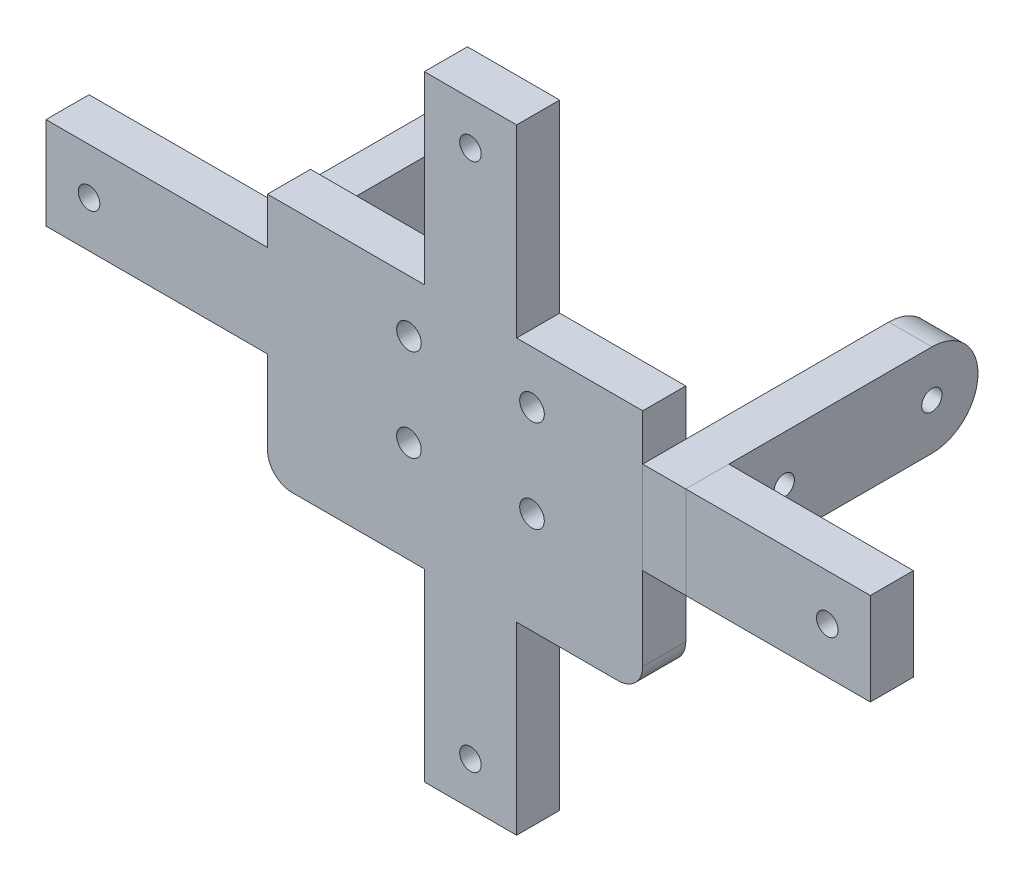
from build123d import *

# Parameters (mm, degrees)
EXTRUDE_START       = 24.2
SKETCH_4_W          = 61
SKETCH_4_H          = 7
EXTRUDE_1_DEPTH     = 6
SKETCH_5_W          = 40
SKETCH_5_H          = 34
SKETCH_5_R          = 2
EXTRUDE_2_DEPTH     = 7
EXTRUDE_START_2     = -9.8
SKETCH_7_R          = 4.1
EXTRUDE_3_DEPTH     = 7
EXTRUDE_START_3     = -55
SKETCH_9_R          = 1.65
EXTRUDE_4_DEPTH     = 6
EXTRUDE_START_4     = -22.5
EXTRUDE_5_DEPTH     = 7
EXTRUDE_START_5     = 28
SKETCH_14_R         = 1.65
EXTRUDE_8_DEPTH     = 7
SKETCH_17_R         = 3
SKETCH_17_R_2       = 1.5
EXTRUDE_11_DEPTH    = 0.5
SKETCH_21_W         = 15
SKETCH_21_H         = 30
SKETCH_21_R         = 1.75
SKETCH_21_W_2       = 30
SKETCH_21_H_2       = 15
EXTRUDE_12_DEPTH    = 7
SKETCH_22_W         = 40
SKETCH_22_H         = 7
CUT_EXTRUDE_1_DEPTH = 23


with BuildPart() as part:
    # 草图4 → 凸台-拉伸1 (new body)
    with BuildSketch(Plane(origin=(0, 0, 0), x_dir=(1, 0, 0), z_dir=(0, 1, 0)).offset(EXTRUDE_START)):
        with Locations((-2.5, 26)):
            Rectangle(SKETCH_4_W, SKETCH_4_H)
    extrude(amount=EXTRUDE_1_DEPTH)

    # 草图5 → 凸台-拉伸2 (add)
    with BuildSketch(Plane(origin=(0, 0, -29.5), x_dir=(-1, 0, 0), z_dir=(0, 0, -1))):
        with Locations((0, 7.2)):
            Rectangle(SKETCH_5_W, SKETCH_5_H)
        with Locations((-10, 21.7)):
            Circle(SKETCH_5_R, mode=Mode.SUBTRACT)
        with Locations(Location((10, 21.7, 0), (0, 0, 180))):
            Circle(SKETCH_5_R, mode=Mode.SUBTRACT)
        with Locations((10, 6.7)):
            Circle(SKETCH_5_R, mode=Mode.SUBTRACT)
        with Locations(Location((-10, 6.7, 0), (0, 0, 180))):
            Circle(SKETCH_5_R, mode=Mode.SUBTRACT)
    extrude(amount=-EXTRUDE_2_DEPTH)

    # 草图7 → 凸台-拉伸3 (add)
    with BuildSketch(Plane(origin=(0, 0, 0), x_dir=(1, 0, 0), z_dir=(0, 1, 0)).offset(EXTRUDE_START_2)):
        with BuildLine():
            Line((20, 22.5), (-20, 22.5))
            Line((-20, 22.5), (-20, 2.5))
            ThreePointArc((-20, 2.5), (-19.121320344, 0.378679656), (-17, -0.5))
            Line((-17, -0.5), (17, -0.5))
            ThreePointArc((17, -0.5), (19.121320344, 0.378679656), (20, 2.5))
            Line((20, 2.5), (20, 22.5))
        make_face()
        with Locations(Location((10, 10, 0), (0, 0, 90))):
            Circle(SKETCH_7_R, mode=Mode.SUBTRACT)
    extrude(amount=EXTRUDE_3_DEPTH)



with BuildPart() as body_2:
    # 草图9 → 凸台-拉伸4 (new body)
    with BuildSketch(Plane(origin=(22, 25.2, -43.868265324), x_dir=(0, 0, 1), z_dir=(1, 0, 0)).offset(EXTRUDE_START_3)):
        with BuildLine():
            Line((-18.631734676, 2.5), (21.368265324, 2.5))
            Line((21.368265324, 2.5), (21.368265324, 17.5))
            Line((21.368265324, 17.5), (-18.631734676, 17.5))
            ThreePointArc((-18.631734676, 17.5), (-26.131734676, 10), (-18.631734676, 2.5))
        make_face()
        with Locations((-18.631734676, 10)):
            Circle(SKETCH_9_R, mode=Mode.SUBTRACT)
    extrude(amount=-EXTRUDE_4_DEPTH)


with BuildPart() as part_1:
    add(part.part)

    add(body_2.part)  # 凸台-拉伸5 merges body 2
    # 草图10 → 凸台-拉伸5 (add)
    with BuildSketch(Plane.XY.offset(EXTRUDE_START_4)):
        with BuildLine():
            Line((-33, 30.2), (-20, 30.2))
            Line((-20, 30.2), (-20, -9.8))
            Line((-20, -9.8), (-29, -9.8))
            ThreePointArc((-29, -9.8), (-31.828427125, -8.628427125), (-33, -5.8))
            Line((-33, -5.8), (-33, 30.2))
        make_face()
    extrude(amount=-EXTRUDE_5_DEPTH)

    # 草图21 → 凸台-拉伸12 (add)
    # profile 1 of 5: a face of its own
    with BuildSketch(Plane.XY.offset(EXTRUDE_START_4)):
        with Locations((0, 45.2)):
            Rectangle(SKETCH_21_W, SKETCH_21_H)
        with Locations((0, 53.2)):
            Circle(SKETCH_21_R, mode=Mode.SUBTRACT)
    # profile 2 of 5: a face of its own
    with BuildSketch(Plane.XY.offset(EXTRUDE_START_4)):
        with Locations((-54, 15.2)):
            Rectangle(SKETCH_21_W_2, SKETCH_21_H_2)
        with Locations((-62, 15.2)):
            Circle(SKETCH_21_R, mode=Mode.SUBTRACT)
    # profile 3 of 5: a face of its own
    with BuildSketch(Plane.XY.offset(EXTRUDE_START_4)):
        with Locations((50, 15.2)):
            Rectangle(SKETCH_21_W_2, SKETCH_21_H_2)
        with Locations((58, 15.2)):
            Circle(SKETCH_21_R, mode=Mode.SUBTRACT)
    # profile 4 of 5: a face of its own
    with BuildSketch(Plane.XY.offset(EXTRUDE_START_4)):
        with Locations((0, -24.8)):
            Rectangle(SKETCH_21_W, SKETCH_21_H)
        with Locations((0, -32.8)):
            Circle(SKETCH_21_R, mode=Mode.SUBTRACT)
    # profile 5 of 5: a face of its own
    with BuildSketch(Plane.XY.offset(EXTRUDE_START_4)):
        with BuildLine():
            Line((20, -9.8), (20, 24.2))
            Line((20, 24.2), (28, 24.2))
            Line((28, 24.2), (28, -5.8))
            ThreePointArc((28, -5.8), (26.828427125, -8.628427125), (24, -9.8))
            Line((24, -9.8), (20, -9.8))
        make_face()
    extrude(amount=-EXTRUDE_12_DEPTH)


with BuildPart() as body_2_2:
    # 草图14 → 凸台-拉伸8 (new body)
    with BuildSketch(Plane(origin=(0, 0, 0), x_dir=(0, 0, -1), z_dir=(1, 0, 0)).offset(EXTRUDE_START_5)):
        with BuildLine():
            Line((22.5, 22.7), (62.5, 22.7))
            ThreePointArc((62.5, 22.7), (70, 15.2), (62.5, 7.7))
            Line((62.5, 7.7), (22.5, 7.7))
            Line((22.5, 7.7), (22.5, 22.7))
        make_face()
        with Locations((38.5, 15.2)):
            Circle(SKETCH_14_R, mode=Mode.SUBTRACT)
        with Locations((62.5, 15.2)):
            Circle(SKETCH_14_R, mode=Mode.SUBTRACT)
    extrude(amount=EXTRUDE_8_DEPTH)


with BuildPart() as body_3:
    # 草图17 → 凸台-拉伸11 (new body)
    with BuildSketch(Plane(origin=(-33, 0, 0), x_dir=(0, 0, -1), z_dir=(1, 0, 0))):
        with Locations(Location((62.5, 15.2, 0), (0, 0, 90))):
            Circle(SKETCH_17_R)
        with Locations(Location((62.5, 15.2, 0), (0, 0, 90))):
            Circle(SKETCH_17_R_2, mode=Mode.SUBTRACT)
    extrude(amount=EXTRUDE_11_DEPTH)


with BuildPart() as extrude_12_piece_1:
    # of the separate pieces the step leaves, piece 1, a body of its own (extrude_12_pieces)
    add(part_1.part.solids().sort_by_distance((28, 30.2, -22.5))[0])

    # 草图22 → 切除-拉伸1 (cut)
    with BuildSketch(Plane.XY.offset(-22.5)):
        with Locations((0, -6.3)):
            Rectangle(SKETCH_22_W, SKETCH_22_H)
    extrude(amount=CUT_EXTRUDE_1_DEPTH, mode=Mode.SUBTRACT)


with BuildPart() as extrude_12_piece_2:
    # of the separate pieces the step leaves, piece 2, a body of its own (extrude_12_pieces)
    add(part_1.part.solids().sort_by_distance((35, 22.7, -22.5))[0])


solid = Compound([body_2_2.part, body_3.part, extrude_12_piece_1.part, extrude_12_piece_2.part])
